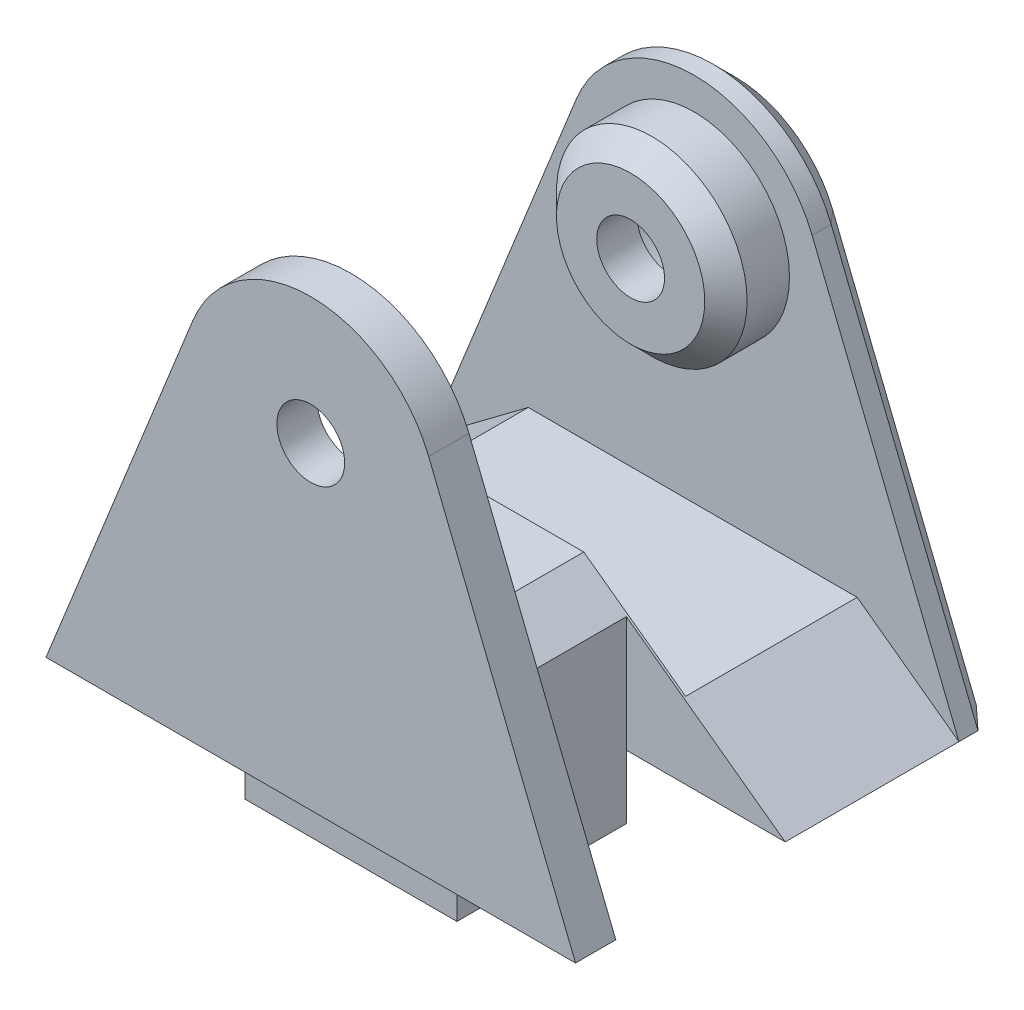
from build123d import *

# Parameters (mm, degrees)
CROQUIS1_R                 = 1.6
SALIENTE_EXTRUIR1_DEPTH    = 10
CORTAR_EXTRUIR1_DEPTH      = 8.1
CORTAR_EXTRUIR1_DEPTH_BACK = 8.1
CORTAR_EXTRUIR2_START      = 8.1
CROQUIS3_OUTSIDE_W         = 34.658
CROQUIS3_OUTSIDE_H         = 30.658
CROQUIS3_OUTSIDE_W_2       = 10
CROQUIS3_OUTSIDE_H_2       = 25.797501395
CORTAR_EXTRUIR2_DEPTH      = 8
CROQUIS4_W                 = 10
CROQUIS4_H                 = 8
SALIENTE_EXTRUIR3_DEPTH    = 3
CORTAR_EXTRUIR3_DEPTH      = 25.088378941
CORTAR_EXTRUIR3_DEPTH_BACK = 25.088378941
CROQUIS5_W                 = 8.1
CROQUIS5_H                 = 3.5
CROQUIS6_R                 = 4.5
CROQUIS6_R_2               = 1.6
SALIENTE_EXTRUIR4_DEPTH    = 3
CHAFL_N1_SIZE              = 1
CROQUIS7_R                 = 3.5
CORTAR_EXTRUIR4_DEPTH      = 3
CHAFL_N2_SIZE              = 1


with BuildPart() as part:
    # Croquis1 → Saliente-Extruir1 (new, symmetric)
    with BuildSketch(Plane.XY):
        with BuildLine():
            Line((-12.5, -15), (-5.566639674, 2.238866395))
            ThreePointArc((-5.566639674, 2.238866395), (0, 6), (5.566639674, 2.238866395))
            Line((5.566639674, 2.238866395), (12.5, -15))
            Line((12.5, -15), (-12.5, -15))
        make_face()
        Circle(CROQUIS1_R, mode=Mode.SUBTRACT)
    extrude(amount=SALIENTE_EXTRUIR1_DEPTH, both=True)

    # Croquis2 → Cortar-Extruir1 (cut, two sides: drawn at the far end of the back side and taken through both)
    with BuildSketch(Plane.XY.offset(-CORTAR_EXTRUIR1_DEPTH_BACK)):
        with BuildLine():
            Line((-12.5, -15), (-7.5, 0))
            ThreePointArc((-7.5, 0), (0, 7.5), (7.5, 0))
            Line((7.5, 0), (12.5, -15))
            Line((12.5, -15), (2.888582809, -8))
            Line((2.888582809, -8), (-3.164835235, -8))
            Line((-3.164835235, -8), (-12.5, -15))
        make_face()
    extrude(amount=CORTAR_EXTRUIR1_DEPTH + CORTAR_EXTRUIR1_DEPTH_BACK, mode=Mode.SUBTRACT)

    # Croquis3 outside → Cortar-Extruir2 (cut)
    with BuildSketch(Plane.XY.offset(CORTAR_EXTRUIR2_START)):
        with Locations((0, -4.5)):
            Rectangle(CROQUIS3_OUTSIDE_W, CROQUIS3_OUTSIDE_H)
        with Locations((0, -2.101249303)):
            Rectangle(CROQUIS3_OUTSIDE_W_2, CROQUIS3_OUTSIDE_H_2, mode=Mode.SUBTRACT)
    extrude(amount=-CORTAR_EXTRUIR2_DEPTH, mode=Mode.SUBTRACT)

    # Croquis4 → Saliente-Extruir3 (add)
    with BuildSketch(Plane.XZ.offset(15)):
        with Locations((0, 4.1)):
            Rectangle(CROQUIS4_W, CROQUIS4_H)
    extrude(amount=SALIENTE_EXTRUIR3_DEPTH)

    # Croquis5 → Cortar-Extruir3 (cut, two sides: drawn at the far end of the back side and taken through both)
    with BuildSketch(Plane(origin=(0, 0, 0), x_dir=(0, 0, -1), z_dir=(1, 0, 0)).offset(-CORTAR_EXTRUIR3_DEPTH_BACK)):
        with Locations((4.05, -9.75)):
            Rectangle(CROQUIS5_W, CROQUIS5_H)
    extrude(amount=CORTAR_EXTRUIR3_DEPTH + CORTAR_EXTRUIR3_DEPTH_BACK, mode=Mode.SUBTRACT)

    # Croquis6 → Saliente-Extruir4 (add)
    with BuildSketch(Plane.XY.offset(-8.1)):
        Circle(CROQUIS6_R)
        Circle(CROQUIS6_R_2, mode=Mode.SUBTRACT)
    extrude(amount=SALIENTE_EXTRUIR4_DEPTH)

    # Chaflán1
    chafl_n1_edges = [part.edges().sort_by_distance(p)[0] for p in [
        (-4.5, 0, -5.1),
    ]]
    chamfer(chafl_n1_edges, length=CHAFL_N1_SIZE)

    # Croquis7 → Cortar-Extruir4 (cut)
    with BuildSketch(Plane(origin=(0, 0, -10), x_dir=(-1, 0, 0), z_dir=(0, 0, -1))):
        Circle(CROQUIS7_R)
    extrude(amount=-CORTAR_EXTRUIR4_DEPTH, mode=Mode.SUBTRACT)

    # Chaflán2
    chafl_n2_edges = [part.edges().sort_by_distance(p)[0] for p in [
        (-9.033319837, -6.380566802, -10),
        (0, 6, -10),
        (9.033319837, -6.380566802, -10),
    ]]
    chamfer(chafl_n2_edges, length=CHAFL_N2_SIZE)


solid = part.part
